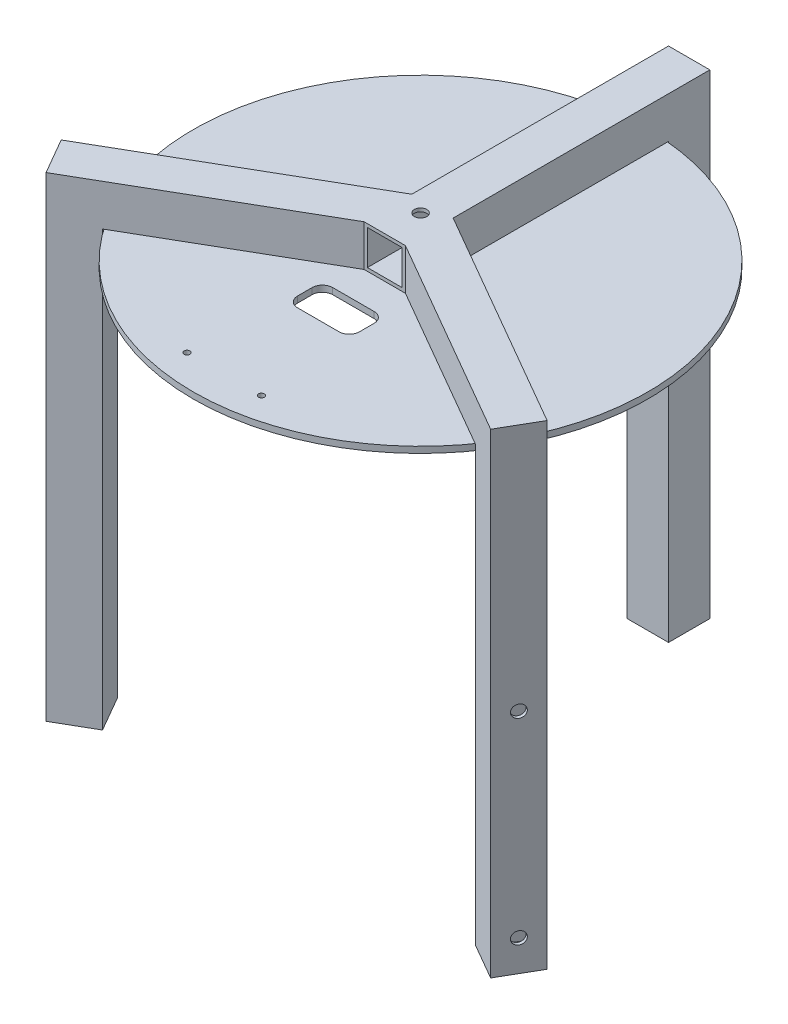
from build123d import *

# Parameters (mm, degrees)
BOSS_EXTRUDE1_DEPTH = 20
CUT_EXTRUDE1_REACH  = 304.327
SKETCH2_W           = 16.8
SKETCH2_H           = 16.8
SKETCH3_W           = 16.8
SKETCH3_H           = 16.8
CUT_EXTRUDE2_DEPTH  = 147.320508076
CUT_EXTRUDE4_REACH  = 304.327
SKETCH4_W           = 16.8
SKETCH4_H           = 16.8
CUT_EXTRUDE5_REACH  = 185.242
CUT_EXTRUDE6_REACH  = 175.638
CUT_EXTRUDE7_REACH  = 188.154
BOSS_EXTRUDE2_DEPTH = 20
CUT_EXTRUDE8_DEPTH  = 228.4
BOSS_EXTRUDE3_DEPTH = 20
SKETCH11_W          = 16.8
SKETCH11_H          = 16.8
CUT_EXTRUDE9_DEPTH  = 228.4
BOSS_EXTRUDE4_DEPTH = 20
CUT_EXTRUDE10_DEPTH = 228.4
CUT_EXTRUDE11_REACH = 369.562
SKETCH14_R          = 3
CUT_EXTRUDE12_REACH = 317.283
SKETCH15_R          = 3
CUT_EXTRUDE13_REACH = 369.562
SKETCH16_R          = 3
SKETCH17_R          = 110
BOSS_EXTRUDE6_DEPTH = 3
SKETCH18_R          = 3
CUT_EXTRUDE14_DEPTH = 1.6
CUT_EXTRUDE15_START = -4.6
SKETCH19_R          = 1.425
CUT_EXTRUDE15_DEPTH = 4.6
SKETCH20_R          = 1.425
CUT_EXTRUDE16_DEPTH = 3


with BuildPart() as part:
    # Sketch1 → Boss-Extrude1 (new body)
    with BuildSketch(Plane(origin=(0, 0, 0), x_dir=(1, 0, 0), z_dir=(0, 1, 0))):
        Polygon((-10, 130), (10, 130), (10, 5.773502692), (117.583302492, -56.339745962), (107.583302492, -73.660254038), (10, -17.320508076), (-10, -17.320508076), (-107.583302492, -73.660254038), (-117.583302492, -56.339745962), (-10, 5.773502692), align=None)
    extrude(amount=BOSS_EXTRUDE1_DEPTH)

    # Cut-Extrude1: up to this plane
    cut_extrude1_end = Plane(origin=(10, 20, -130), z_dir=(-1, 0, 0))
    # Sketch2 → Cut-Extrude1 (cut, up to the surface)
    with BuildSketch(Plane(origin=(112.583302492, 0, 65), x_dir=(0.4999999999999971, 0, -0.8660254037844403), z_dir=(0.8660254037844404, 0, 0.49999999999999717)), mode=Mode.PRIVATE) as cut_extrude1_sk1:
        with Locations((0, 10)):
            Rectangle(SKETCH2_W, SKETCH2_H)
    cut_extrude1_tool1 = split(extrude(cut_extrude1_sk1.sketch, amount=-CUT_EXTRUDE1_REACH, mode=Mode.PRIVATE), bisect_by=cut_extrude1_end, keep=Keep.BOTH, mode=Mode.PRIVATE)
    add(cut_extrude1_tool1.solids().sort_by_distance((112.583302, 10, 65))[0], mode=Mode.SUBTRACT)

    # Sketch3 → Cut-Extrude2 (cut)
    with BuildSketch(Plane(origin=(0, 0, -130), x_dir=(-1, 0, 0), z_dir=(0, 0, -1))):
        with Locations((0, 10)):
            Rectangle(SKETCH3_W, SKETCH3_H)
    extrude(amount=-CUT_EXTRUDE2_DEPTH, mode=Mode.SUBTRACT)

    # Cut-Extrude4: up to this plane
    cut_extrude4_end = Plane(origin=(-10, 20, -130), z_dir=(1, 0, 0))
    # Sketch4 → Cut-Extrude4 (cut, up to the surface)
    with BuildSketch(Plane(origin=(-112.583302492, 0, 65), x_dir=(0.5000000000000071, 0, 0.8660254037844346), z_dir=(-0.8660254037844346, 0, 0.5000000000000071)), mode=Mode.PRIVATE) as cut_extrude4_sk1:
        with Locations((0, 10)):
            Rectangle(SKETCH4_W, SKETCH4_H)
    cut_extrude4_tool1 = split(extrude(cut_extrude4_sk1.sketch, amount=-CUT_EXTRUDE4_REACH, mode=Mode.PRIVATE), bisect_by=cut_extrude4_end, keep=Keep.BOTH, mode=Mode.PRIVATE)
    add(cut_extrude4_tool1.solids().sort_by_distance((-112.583302, 10, 65))[0], mode=Mode.SUBTRACT)

    # Cut-Extrude5: up to this face of the body (flat: up to its plane)
    cut_extrude5_end = Plane(part.part.faces().sort_by_distance((10, 10, -67.886751346))[0])
    # Sketch5 → Cut-Extrude5 (cut, up to the picked face)
    with BuildSketch(Plane.ZY.offset(10), mode=Mode.PRIVATE) as cut_extrude5_sk1:
        Polygon((-130, 20), (-110, 0), (-130, 0), align=None)
    cut_extrude5_tool1 = split(extrude(cut_extrude5_sk1.sketch, amount=-CUT_EXTRUDE5_REACH, mode=Mode.PRIVATE), bisect_by=cut_extrude5_end, keep=Keep.BOTH, mode=Mode.PRIVATE)
    add(cut_extrude5_tool1.solids().sort_by(Axis((-10, 6.666667, -123.333333), (1, 0, 0)))[0], mode=Mode.SUBTRACT)

    # Cut-Extrude6: up to this face of the body (flat: up to its plane)
    cut_extrude6_end = Plane(part.part.faces().sort_by_distance((-58.791651246, 10, 45.490381057))[0])
    # Sketch6 → Cut-Extrude6 (cut, up to the picked face)
    with BuildSketch(Plane(origin=(-5, 0, -8.660254038), x_dir=(-0.8660254037844363, 0, 0.5000000000000042), z_dir=(-0.5000000000000042, 0, -0.8660254037844363)), mode=Mode.PRIVATE) as cut_extrude6_sk1:
        Polygon((130, 20), (110, 0), (130, 0), align=None)
    cut_extrude6_tool1 = split(extrude(cut_extrude6_sk1.sketch, amount=-CUT_EXTRUDE6_REACH, mode=Mode.PRIVATE), bisect_by=cut_extrude6_end, keep=Keep.BOTH, mode=Mode.PRIVATE)
    add(cut_extrude6_tool1.solids().sort_by(Axis((-111.8098, 6.666667, 53.006413), (0.5000000000000042, 0, 0.8660254037844363)))[0], mode=Mode.SUBTRACT)

    # Cut-Extrude7: up to this face of the body (flat: up to its plane)
    cut_extrude7_end = Plane(part.part.faces().sort_by_distance((63.791651246, 10, 25.283121635))[0])
    # Sketch7 → Cut-Extrude7 (cut, up to the picked face)
    with BuildSketch(Plane(origin=(-5, 0, 8.660254038), x_dir=(0.8660254037844403, 0, 0.4999999999999973), z_dir=(-0.4999999999999973, 0, 0.8660254037844403)), mode=Mode.PRIVATE) as cut_extrude7_sk1:
        Polygon((130, 20), (130, 0), (110, 0), align=None)
    cut_extrude7_tool1 = split(extrude(cut_extrude7_sk1.sketch, amount=-CUT_EXTRUDE7_REACH, mode=Mode.PRIVATE), bisect_by=cut_extrude7_end, keep=Keep.BOTH, mode=Mode.PRIVATE)
    add(cut_extrude7_tool1.solids().sort_by(Axis((101.8098, 6.666667, 70.326921), (0.4999999999999973, 0, -0.8660254037844403)))[0], mode=Mode.SUBTRACT)

    # Sketch8 → Boss-Extrude2 (add)
    with BuildSketch(Plane(origin=(-5, 0, 8.660254038), x_dir=(0.8660254037844403, 0, 0.4999999999999973), z_dir=(-0.4999999999999973, 0, 0.8660254037844403))):
        Polygon((130, 20), (130, -210), (110, -210), (110, 0), align=None)
    extrude(amount=-BOSS_EXTRUDE2_DEPTH)

    # Sketch9 → Cut-Extrude8 (cut)
    with BuildSketch(Plane.XZ.offset(210)):
        Polygon((100.848435062, 48.525386608), (115.397661846, 56.925386608), (106.997661846, 71.474613392), (92.448435062, 63.074613392), align=None)
    extrude(amount=-CUT_EXTRUDE8_DEPTH, mode=Mode.SUBTRACT)

    # Sketch10 → Boss-Extrude3 (add)
    with BuildSketch(Plane(origin=(10, 0, 0), x_dir=(0, 0, -1), z_dir=(1, 0, 0))):
        Polygon((130, 20), (130, -210), (110, -210), (110, 0), align=None)
    extrude(amount=-BOSS_EXTRUDE3_DEPTH)

    # Sketch11 → Cut-Extrude9 (cut)
    with BuildSketch(Plane.XZ.offset(210)):
        with Locations((0, -120)):
            Rectangle(SKETCH11_W, SKETCH11_H)
    extrude(amount=-CUT_EXTRUDE9_DEPTH, mode=Mode.SUBTRACT)

    # Sketch12 → Boss-Extrude4 (add)
    with BuildSketch(Plane(origin=(-5, 0, -8.660254038), x_dir=(-0.8660254037844363, 0, 0.5000000000000042), z_dir=(-0.5000000000000042, 0, -0.8660254037844363))):
        Polygon((130, 20), (130, -210), (110, -210), (110, 0), align=None)
    extrude(amount=-BOSS_EXTRUDE4_DEPTH)

    # Sketch13 → Cut-Extrude10 (cut)
    with BuildSketch(Plane.XZ.offset(210)):
        Polygon((-92.448435062, 63.074613392), (-106.997661846, 71.474613392), (-115.397661846, 56.925386608), (-100.848435062, 48.525386608), align=None)
    extrude(amount=-CUT_EXTRUDE10_DEPTH, mode=Mode.SUBTRACT)

    # Sketch14 → Cut-Extrude11 (cut, up to next)
    with BuildSketch(Plane(origin=(-112.583302492, 0, 65), x_dir=(0.5000000000000042, 0, 0.8660254037844363), z_dir=(-0.8660254037844363, -1.0553382477548879e-15, 0.5000000000000042)), mode=Mode.PRIVATE) as cut_extrude11_sk1:
        with Locations((0, -100)):
            Circle(SKETCH14_R)
    cut_extrude11_tool1 = extrude(cut_extrude11_sk1.sketch, amount=-CUT_EXTRUDE11_REACH, mode=Mode.PRIVATE) & part.part
    # Sketch14 → Cut-Extrude11 (cut, up to next)
    with BuildSketch(Plane(origin=(-112.583302492, 0, 65), x_dir=(0.5000000000000042, 0, 0.8660254037844363), z_dir=(-0.8660254037844363, -1.0553382477548879e-15, 0.5000000000000042)), mode=Mode.PRIVATE) as cut_extrude11_sk2:
        with Locations((0, -195)):
            Circle(SKETCH14_R)
    cut_extrude11_tool2 = extrude(cut_extrude11_sk2.sketch, amount=-CUT_EXTRUDE11_REACH, mode=Mode.PRIVATE) & part.part
    add(cut_extrude11_tool1.solids().sort_by_distance((-112.583302, -100, 65))[0], mode=Mode.SUBTRACT)
    add(cut_extrude11_tool2.solids().sort_by_distance((-112.583302, -195, 65))[0], mode=Mode.SUBTRACT)

    # Sketch15 → Cut-Extrude12 (cut, up to next)
    with BuildSketch(Plane(origin=(0, 0, -130), x_dir=(-1, 0, 0), z_dir=(0, 0, -1)), mode=Mode.PRIVATE) as cut_extrude12_sk1:
        with Locations(Location((0, -100, 0), (0, 0, 90))):
            Circle(SKETCH15_R)
    cut_extrude12_tool1 = extrude(cut_extrude12_sk1.sketch, amount=-CUT_EXTRUDE12_REACH, mode=Mode.PRIVATE) & part.part
    # Sketch15 → Cut-Extrude12 (cut, up to next)
    with BuildSketch(Plane(origin=(0, 0, -130), x_dir=(-1, 0, 0), z_dir=(0, 0, -1)), mode=Mode.PRIVATE) as cut_extrude12_sk2:
        with Locations(Location((0, -195, 0), (0, 0, 90))):
            Circle(SKETCH15_R)
    cut_extrude12_tool2 = extrude(cut_extrude12_sk2.sketch, amount=-CUT_EXTRUDE12_REACH, mode=Mode.PRIVATE) & part.part
    add(cut_extrude12_tool1.solids().sort_by_distance((0, -100, -130))[0], mode=Mode.SUBTRACT)
    add(cut_extrude12_tool2.solids().sort_by_distance((0, -195, -130))[0], mode=Mode.SUBTRACT)

    # Sketch16 → Cut-Extrude13 (cut, up to next)
    with BuildSketch(Plane(origin=(112.583302492, 0, 65), x_dir=(0.4999999999999973, 0, -0.8660254037844403), z_dir=(0.8660254037844403, 0, 0.4999999999999973)), mode=Mode.PRIVATE) as cut_extrude13_sk1:
        with Locations((0, -100)):
            Circle(SKETCH16_R)
    cut_extrude13_tool1 = extrude(cut_extrude13_sk1.sketch, amount=-CUT_EXTRUDE13_REACH, mode=Mode.PRIVATE) & part.part
    # Sketch16 → Cut-Extrude13 (cut, up to next)
    with BuildSketch(Plane(origin=(112.583302492, 0, 65), x_dir=(0.4999999999999973, 0, -0.8660254037844403), z_dir=(0.8660254037844403, 0, 0.4999999999999973)), mode=Mode.PRIVATE) as cut_extrude13_sk2:
        with Locations((0, -195)):
            Circle(SKETCH16_R)
    cut_extrude13_tool2 = extrude(cut_extrude13_sk2.sketch, amount=-CUT_EXTRUDE13_REACH, mode=Mode.PRIVATE) & part.part
    add(cut_extrude13_tool1.solids().sort_by_distance((112.583302, -100, 65))[0], mode=Mode.SUBTRACT)
    add(cut_extrude13_tool2.solids().sort_by_distance((112.583302, -195, 65))[0], mode=Mode.SUBTRACT)

    # Sketch18 → Cut-Extrude14 (cut)
    with BuildSketch(Plane(origin=(0, 20, 0), x_dir=(1, 0, 0), z_dir=(0, 1, 0))):
        with Locations(Location((0, 0, 0), (0, 0, 270))):
            Circle(SKETCH18_R)
    extrude(amount=-CUT_EXTRUDE14_DEPTH, mode=Mode.SUBTRACT)


with BuildPart() as body_2:
    # Sketch17 → Boss-Extrude6 (new body)
    with BuildSketch(Plane.XZ):
        with Locations(Location((0, 0, 0), (0, 0, 270))):
            Circle(SKETCH17_R)
    extrude(amount=BOSS_EXTRUDE6_DEPTH)


with BuildPart() as cut_extrude15_tool:
    # Sketch19 → Cut-Extrude15 (new body)
    with BuildSketch(Plane(origin=(0, 1.6, 0), x_dir=(1, 0, 0), z_dir=(0, 1, 0)).offset(CUT_EXTRUDE15_START)):
        with Locations(Location((0, 0, 0), (0, 0, 90))):
            Circle(SKETCH19_R)
    extrude(amount=CUT_EXTRUDE15_DEPTH)


with BuildPart() as part_1:
    add(part.part)

    # Cut-Extrude15: cut by cut_extrude15_tool
    add(cut_extrude15_tool.part, mode=Mode.SUBTRACT)


with BuildPart() as body_2_1:
    add(body_2.part)

    # Cut-Extrude15: cut by cut_extrude15_tool
    add(cut_extrude15_tool.part, mode=Mode.SUBTRACT)

    # Sketch20 → Cut-Extrude16 (cut)
    with BuildSketch(Plane(origin=(0, 0, 0), x_dir=(1, 0, 0), z_dir=(0, 1, 0))):
        with Locations(Location((18, -95, 0), (0, 0, 270))):
            Circle(SKETCH20_R)
        with Locations(Location((-18, -95, 0), (0, 0, 90))):
            Circle(SKETCH20_R)
        with BuildLine():
            Line((-10, -32.5), (10, -32.5))
            ThreePointArc((10, -32.5), (13.535533906, -33.964466094), (15, -37.5))
            Line((15, -37.5), (15, -44.5))
            ThreePointArc((15, -44.5), (13.535533906, -48.035533906), (10, -49.5))
            Line((10, -49.5), (-10, -49.5))
            ThreePointArc((-10, -49.5), (-13.535533906, -48.035533906), (-15, -44.5))
            Line((-15, -44.5), (-15, -37.5))
            ThreePointArc((-15, -37.5), (-13.535533906, -33.964466094), (-10, -32.5))
        make_face()
    extrude(amount=-CUT_EXTRUDE16_DEPTH, mode=Mode.SUBTRACT)


solid = Compound([part_1.part, body_2_1.part])
